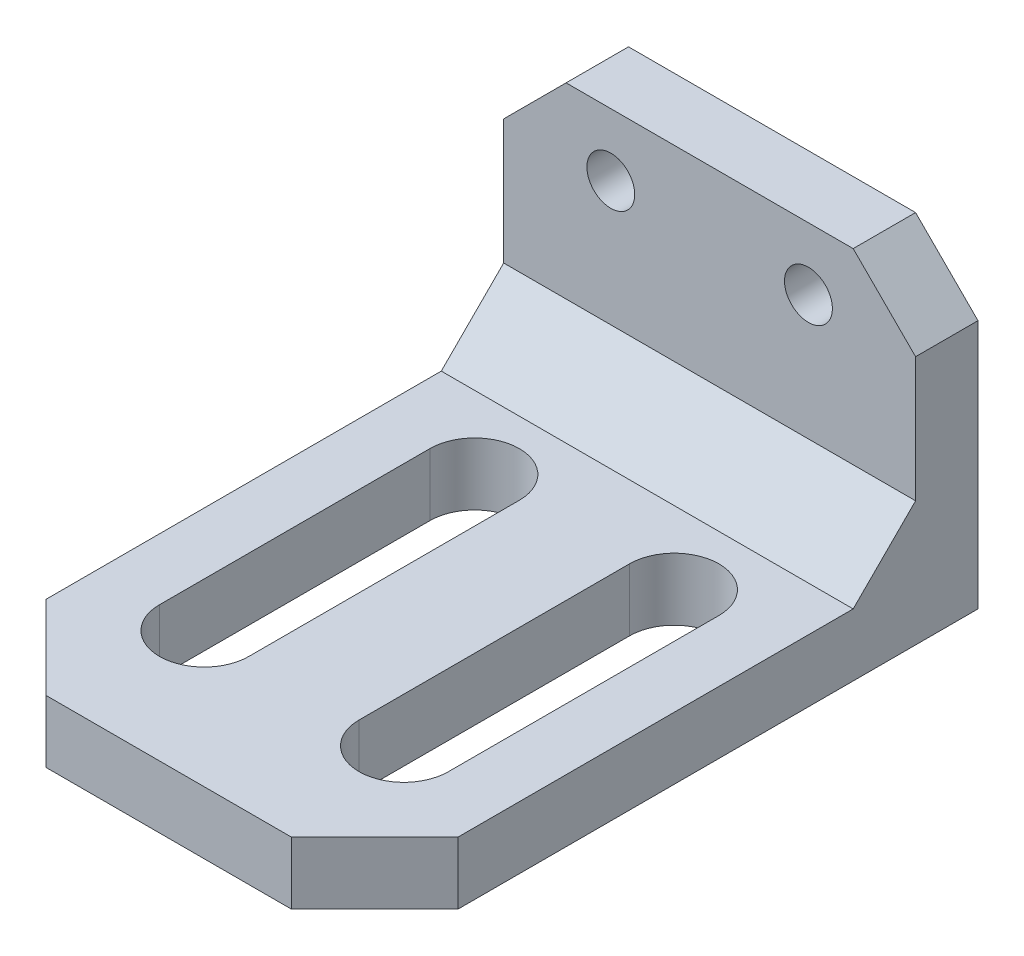
from build123d import *

# Parameters (mm, degrees)
SKETCH1_W           = 19.8
SKETCH1_H           = 15
SKETCH1_R           = 1.15
BOSS_EXTRUDE1_DEPTH = 3
SKETCH2_W           = 19.8
SKETCH2_H           = 3
BOSS_EXTRUDE2_DEPTH = 26
CHAMFER1_SIZE       = 3
CUT_EXTRUDE1_DEPTH  = 15
CHAMFER2_SIZE       = 4


with BuildPart() as part:
    # Sketch1 → Boss-Extrude1 (new body)
    with BuildSketch(Plane.XY):
        with Locations((0, 6.287671233)):
            Rectangle(SKETCH1_W, SKETCH1_H)
        with Locations((-4.75, 10.787671233)):
            Circle(SKETCH1_R, mode=Mode.SUBTRACT)
        with Locations(Location((4.75, 10.787671233, 0), (0, 0, 180))):
            Circle(SKETCH1_R, mode=Mode.SUBTRACT)
    extrude(amount=BOSS_EXTRUDE1_DEPTH)

    # Sketch2 → Boss-Extrude2 (add)
    with BuildSketch(Plane.XY.offset(3)):
        with Locations((0, 0.287671233)):
            Rectangle(SKETCH2_W, SKETCH2_H)
    extrude(amount=BOSS_EXTRUDE2_DEPTH)

    # Chamfer1
    chamfer1_edges = [part.edges().sort_by_distance(p)[0] for p in [
        (0, 1.787671233, 3),
        (-9.9, 13.787671233, 1.5),
        (9.9, 13.787671233, 1.5),
    ]]
    chamfer(chamfer1_edges, length=CHAMFER1_SIZE)

    # Sketch4 → Cut-Extrude1 (cut)
    with BuildSketch(Plane(origin=(0, 1.787671233, 0), x_dir=(1, 0, 0), z_dir=(0, 1, 0))):
        with BuildLine():
            Line((2.647058824, -22.5), (2.647058824, -9.5))
            ThreePointArc((2.647058824, -9.5), (4.797058824, -7.35), (6.947058824, -9.5))
            Line((6.947058824, -9.5), (6.947058824, -22.5))
            ThreePointArc((6.947058824, -22.5), (4.797058824, -24.65), (2.647058824, -22.5))
        make_face()
        with BuildLine():
            Line((-2.647058824, -22.5), (-2.647058824, -9.5))
            ThreePointArc((-2.647058824, -9.5), (-4.797058824, -7.35), (-6.947058824, -9.5))
            Line((-6.947058824, -9.5), (-6.947058824, -22.5))
            ThreePointArc((-6.947058824, -22.5), (-4.797058824, -24.65), (-2.647058824, -22.5))
        make_face()
    extrude(amount=-CUT_EXTRUDE1_DEPTH, mode=Mode.SUBTRACT)

    # Chamfer2
    chamfer2_edges = [part.edges().sort_by_distance(p)[0] for p in [
        (-9.9, 0.287671233, 29),
        (9.9, 0.287671233, 29),
    ]]
    chamfer(chamfer2_edges, length=CHAMFER2_SIZE)


solid = part.part
